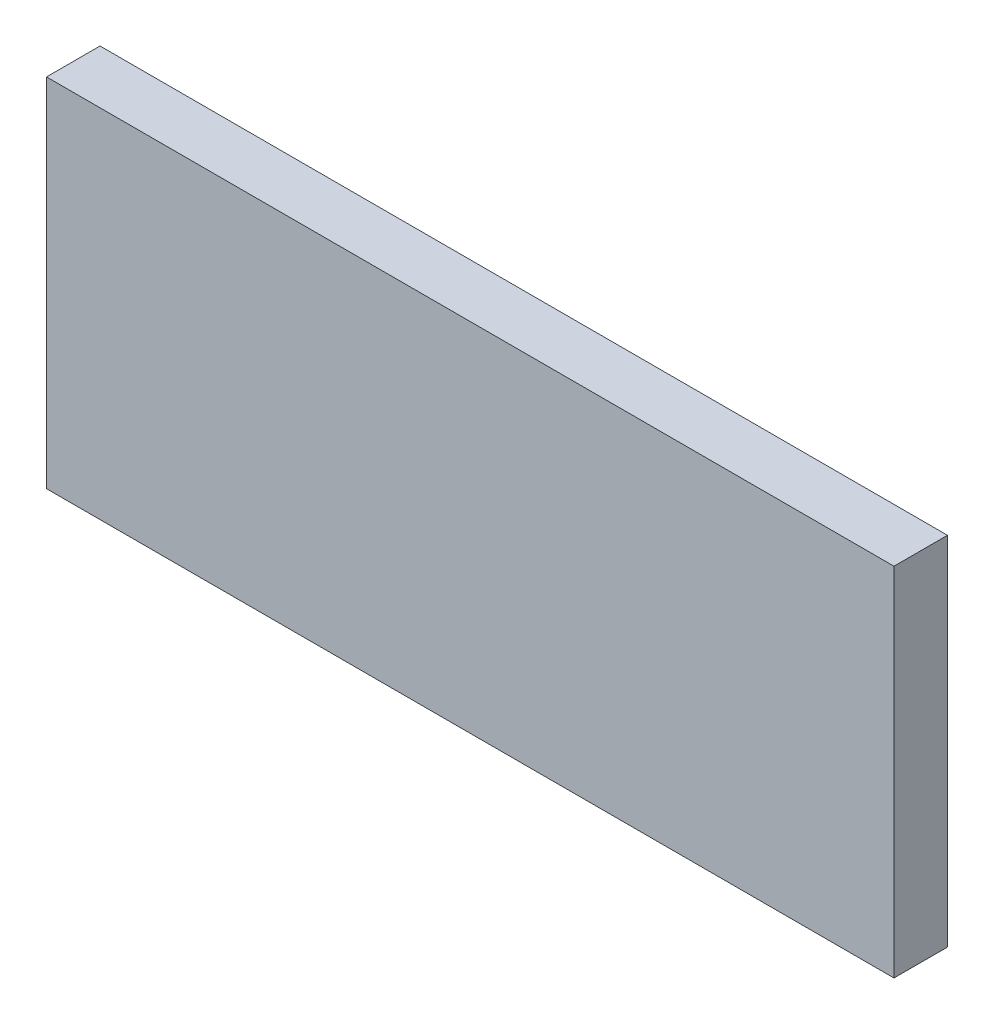
from build123d import *

# Parameters (mm, degrees)
SKETCH1_W           = 158.307493488
SKETCH1_H           = 66.619639343
BOSS_EXTRUDE1_DEPTH = 10


with BuildPart() as part:
    # Sketch1 → Boss-Extrude1 (new body)
    with BuildSketch(Plane.XY):
        with Locations((-7.38310436, 0.171700102)):
            Rectangle(SKETCH1_W, SKETCH1_H)
    extrude(amount=BOSS_EXTRUDE1_DEPTH)


solid = part.part
